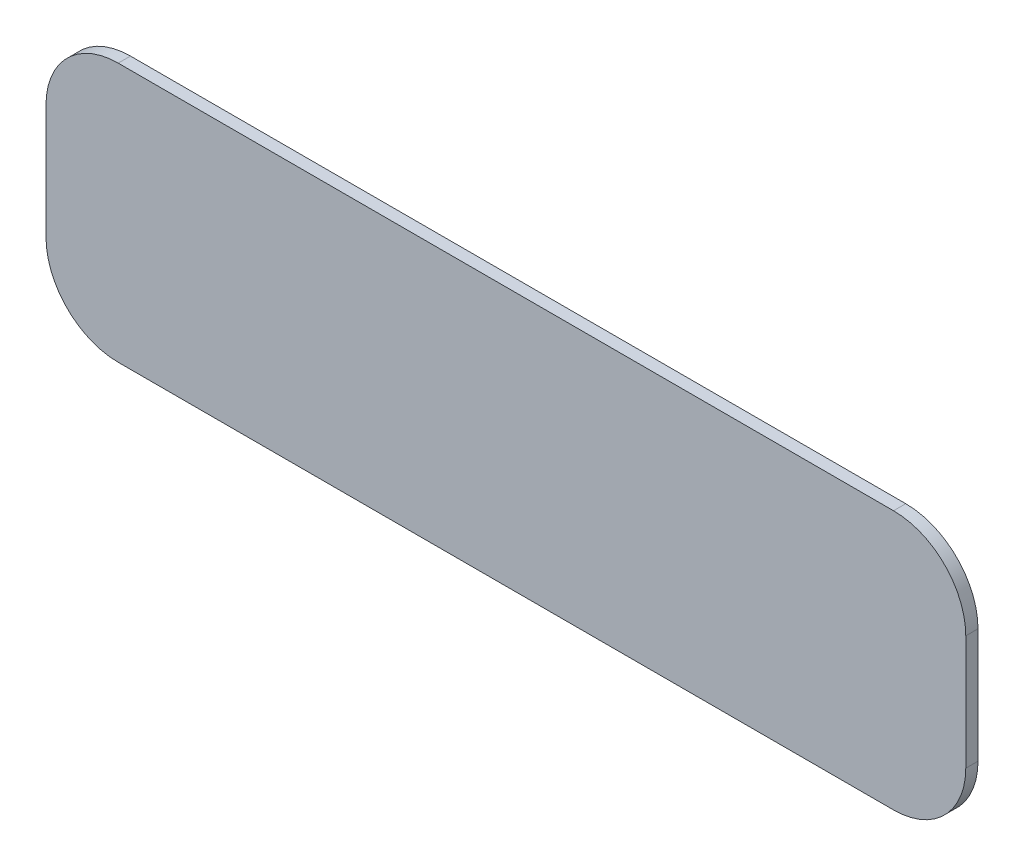
from build123d import *

# Parameters (mm, degrees)
BOSS_EXTRU_1_DEPTH = 3


with BuildPart() as part:
    # Esquisse1 → Boss.-Extru.1 (new body)
    with BuildSketch(Plane.XY):
        with BuildLine():
            Line((-95, -31.75), (95, -31.75))
            ThreePointArc((95, -31.75), (107.515790027, -26.565790027), (112.7, -14.05))
            Line((112.7, -14.05), (112.7, 14.05))
            ThreePointArc((112.7, 14.05), (107.515790027, 26.565790027), (95, 31.75))
            Line((95, 31.75), (-95, 31.75))
            ThreePointArc((-95, 31.75), (-107.515790027, 26.565790027), (-112.7, 14.05))
            Line((-112.7, 14.05), (-112.7, -14.05))
            ThreePointArc((-112.7, -14.05), (-107.515790027, -26.565790027), (-95, -31.75))
        make_face()
    extrude(amount=BOSS_EXTRU_1_DEPTH)


solid = part.part
